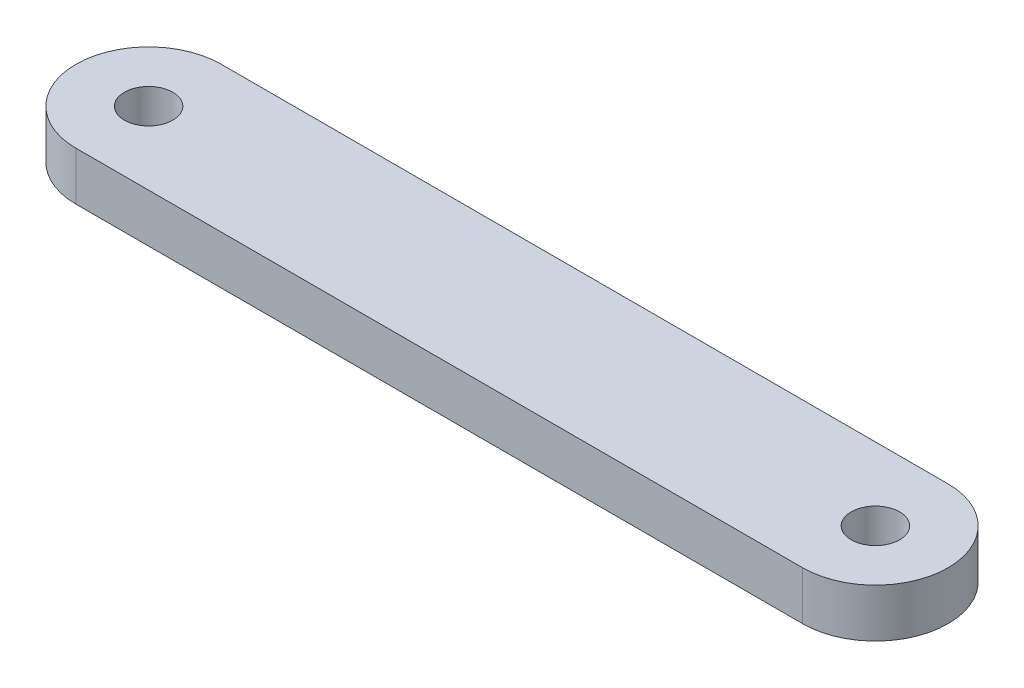
from build123d import *

# Parameters (mm, degrees)
SKETCH1_R           = 2.5
BOSS_EXTRUDE1_DEPTH = 5


with BuildPart() as part:
    # Sketch1 → Boss-Extrude1 (new body)
    with BuildSketch(Plane(origin=(0, 0, 0), x_dir=(1, 0, 0), z_dir=(0, 1, 0))):
        with BuildLine():
            Line((-37.5, 7.5), (37.5, 7.5))
            ThreePointArc((37.5, 7.5), (45, 0), (37.5, -7.5))
            Line((37.5, -7.5), (-37.5, -7.5))
            ThreePointArc((-37.5, -7.5), (-45, 0), (-37.5, 7.5))
        make_face()
        with Locations(Location((37.5, 0, 0), (0, 0, 270))):
            Circle(SKETCH1_R, mode=Mode.SUBTRACT)
        with Locations(Location((-37.5, 0, 0), (0, 0, 270))):
            Circle(SKETCH1_R, mode=Mode.SUBTRACT)
    extrude(amount=BOSS_EXTRUDE1_DEPTH)


solid = part.part
